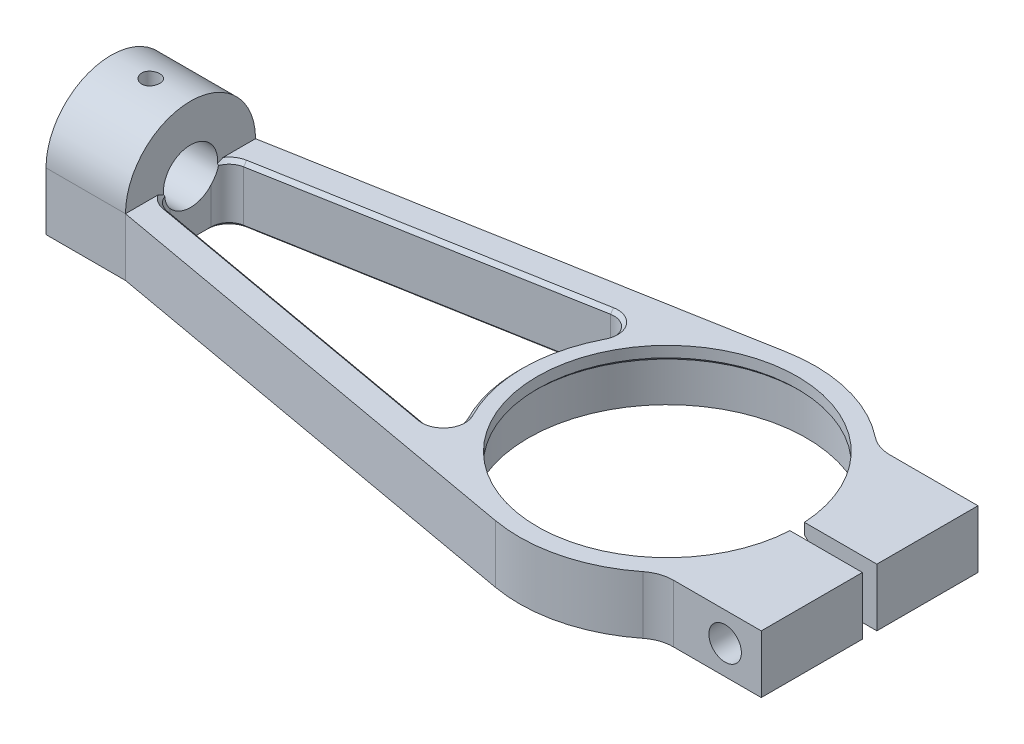
from build123d import *

# Parameters (mm, degrees)
EXTRUDE_1_DEPTH            = 16
CUT_EXTRUDE_1_DEPTH        = 140.143810498
CUT_EXTRUDE_1_DEPTH_BACK   = 140.143810498
SKETCH_2_R                 = 36
CUT_EXTRUDE_2_DEPTH        = 140.143810498
CUT_EXTRUDE_2_DEPTH_BACK   = 12
SKETCH_3_R                 = 38.5
CUT_EXTRUDE_1_2_DEPTH      = 140.143810498
CUT_EXTRUDE_1_2_DEPTH_BACK = 140.143810498
SKETCH_4_W                 = 46.223763545
SKETCH_4_H                 = 4
CUT_EXTRUDE_3_REACH        = 152.735
SKETCH_5_R                 = 4.5
HOLE_WIZARD_M8_1_D         = 6.8
FILLET_1_R                 = 10
EXTRUDE_2_DEPTH            = 22
CUT_EXTRUDE_4_REACH        = 162.378
CHAMFER_1_SIZE             = 1
CHAMFER_2_SIZE             = 1
CUT_EXTRUDE_5_REACH        = 218.649
SKETCH_12_R                = 7.5
F_5_0MM_1_D                = 5
CHAMFER_3_SIZE             = 1


with BuildPart() as part:
    # 草图1 → 凸台-拉伸1 (new body)
    with BuildSketch(Plane(origin=(0, 0, 0), x_dir=(1, 0, 0), z_dir=(0, 1, 0))):
        with BuildLine():
            Line((56, 30), (27.946377225, 30))
            ThreePointArc((27.946377225, 30), (11.579874692, 39.330732286), (-7.231593148, 40.357205807))
            Line((-7.231593148, 40.357205807), (-132, 18))
            Line((-132, 18), (-132, -18))
            Line((-132, -18), (-7.231593148, -40.357205807))
            ThreePointArc((-7.231593148, -40.357205807), (11.579874692, -39.330732286), (27.946377225, -30))
            Line((27.946377225, -30), (56, -30))
            Line((56, -30), (56, 30))
        make_face()
    extrude(amount=EXTRUDE_1_DEPTH)

    # 草图2 → Cut-Extrude 1 (cut, two sides: drawn at the far end of the back side and taken through both)
    with BuildSketch(Plane(origin=(0, 16, 0), x_dir=(1, 0, 0), z_dir=(0, 1, 0)).offset(-CUT_EXTRUDE_1_DEPTH_BACK)):
        with Locations(Location((0, 0, 0), (0, 0, 270))):
            Circle(SKETCH_2_R)
    extrude(amount=CUT_EXTRUDE_1_DEPTH + CUT_EXTRUDE_1_DEPTH_BACK, mode=Mode.SUBTRACT)

    # 草图3 → 切除-拉伸2 (cut, two sides: drawn at the far end of the back side and taken through both)
    with BuildSketch(Plane.XZ.offset(-CUT_EXTRUDE_2_DEPTH_BACK)):
        with Locations(Location((0, 0, 0), (0, 0, 90))):
            Circle(SKETCH_3_R)
    extrude(amount=CUT_EXTRUDE_2_DEPTH + CUT_EXTRUDE_2_DEPTH_BACK, mode=Mode.SUBTRACT)

    # 草图4 → Cut-Extrude 1 2 (cut, two sides: drawn at the far end of the back side and taken through both)
    with BuildSketch(Plane(origin=(0, 16, 0), x_dir=(1, 0, 0), z_dir=(0, 1, 0)).offset(-CUT_EXTRUDE_1_2_DEPTH_BACK)):
        with Locations((51.058258998, 0)):
            Rectangle(SKETCH_4_W, SKETCH_4_H)
    extrude(amount=CUT_EXTRUDE_1_2_DEPTH + CUT_EXTRUDE_1_2_DEPTH_BACK, mode=Mode.SUBTRACT)

    # 草图5 → 切除-拉伸3 (cut, up to next)
    with BuildSketch(Plane.XY.offset(30), mode=Mode.PRIVATE) as cut_extrude_3_sk1:
        with Locations((46, 8)):
            Circle(SKETCH_5_R)
    cut_extrude_3_tool1 = extrude(cut_extrude_3_sk1.sketch, amount=-CUT_EXTRUDE_3_REACH, mode=Mode.PRIVATE) & part.part
    add(cut_extrude_3_tool1.solids().sort_by_distance((46, 8, 30))[0], mode=Mode.SUBTRACT)

    # M8 螺纹孔1 (through all)
    with Locations(Plane.XY.offset(-2)):
        with Locations((46, 8)):
            Hole(HOLE_WIZARD_M8_1_D / 2)

    # 圆角1
    fillet_1_edges = [part.edges().sort_by_distance(p)[0] for p in [
        (27.946377225, 8, 30),
        (27.946377225, 8, -30),
    ]]
    fillet(fillet_1_edges, radius=FILLET_1_R)

    # 草图11 → 凸台-拉伸2 (add)
    with BuildSketch(Plane.ZY.offset(132)):
        with BuildLine():
            Line((-18, 0), (18, 0))
            Line((18, 0), (18, 16))
            ThreePointArc((18, 16), (0, 34), (-18, 16))
            Line((-18, 16), (-18, 0))
        make_face()
    extrude(amount=EXTRUDE_2_DEPTH)

    # 草图13 → 切除-拉伸4 (cut, up to next)
    with BuildSketch(Plane(origin=(0, 16, 0), x_dir=(1, 0, 0), z_dir=(0, 1, 0)), mode=Mode.PRIVATE) as cut_extrude_4_sk1:
        with BuildLine():
            Line((-41.744935847, 26.04535143), (-127.881901603, 10.610499615))
            ThreePointArc((-127.881901603, 10.610499615), (-130.834677823, 8.897509725), (-132, 5.688889151))
            Line((-132, 5.688889151), (-132, -5.688889151))
            ThreePointArc((-132, -5.688889151), (-130.834677823, -8.897509725), (-127.881901603, -10.610499615))
            Line((-127.881901603, -10.610499615), (-41.744935847, -26.04535143))
            ThreePointArc((-41.744935847, -26.04535143), (-36.839154105, -24.091633928), (-36.421400087, -18.827682165))
            ThreePointArc((-36.421400087, -18.827682165), (-41, 0), (-36.421400087, 18.827682165))
            ThreePointArc((-36.421400087, 18.827682165), (-36.839154105, 24.091633928), (-41.744935847, 26.04535143))
        make_face()
    cut_extrude_4_tool1 = extrude(cut_extrude_4_sk1.sketch, amount=-CUT_EXTRUDE_4_REACH, mode=Mode.PRIVATE) & part.part
    add(cut_extrude_4_tool1.solids().sort_by_distance((-78.107907, 16, 0))[0], mode=Mode.SUBTRACT)

    # 倒角1
    chamfer_1_edges = [part.edges().sort_by_distance(p)[0] for p in [
        (-130.834677823, 16, -8.897509725),
        (-130.834677823, 16, 8.897509725),
        (-84.813418725, 16, 18.327925523),
        (-36.839154105, 16, 24.091633928),
        (-41, 16, 0),
        (-36.839154105, 16, -24.091633928),
        (-84.813418725, 16, -18.327925523),
        (-132, 0, 0),
        (-130.834677823, 0, -8.897509725),
        (-84.813418725, 0, -18.327925523),
        (-36.839154105, 0, -24.091633928),
        (-41, 0, 0),
        (-36.839154105, 0, 24.091633928),
        (-84.813418725, 0, 18.327925523),
        (-130.834677823, 0, 8.897509725),
    ]]
    chamfer(chamfer_1_edges, length=CHAMFER_1_SIZE)

    # 倒角2
    chamfer_2_edges = [part.edges().sort_by_distance(p)[0] for p in [
        (-26.153393661, 12, -24.738633754),
    ]]
    chamfer(chamfer_2_edges, length=CHAMFER_2_SIZE)

    # 草图12 → 切除-拉伸5 (cut, up to next)
    with BuildSketch(Plane.ZY.offset(154), mode=Mode.PRIVATE) as cut_extrude_5_sk1:
        with Locations((0, 16)):
            Circle(SKETCH_12_R)
    cut_extrude_5_tool1 = extrude(cut_extrude_5_sk1.sketch, amount=-CUT_EXTRUDE_5_REACH, mode=Mode.PRIVATE) & part.part
    add(cut_extrude_5_tool1.solids().sort_by_distance((-154, 16, 0))[0], mode=Mode.SUBTRACT)

    # Ø5.0mm 暗销孔1 (through all)
    with Locations(Plane(origin=(-143, 34, 0), x_dir=(0, 0, 1), z_dir=(0, 1, 0))):
        with Locations((0, 0)):
            Hole(F_5_0MM_1_D / 2)

    # 倒角3
    chamfer_3_edges = [part.edges().sort_by_distance(p)[0] for p in [
        (-154, 16, -7.5),
    ]]
    chamfer(chamfer_3_edges, length=CHAMFER_3_SIZE)


solid = part.part
